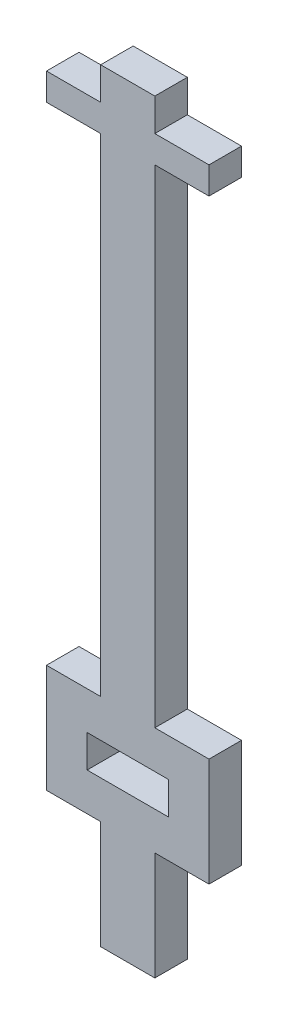
from build123d import *

# Parameters (mm, degrees)
BOSS_EXTRUDE1_DEPTH      = 7.62
BOSS_EXTRUDE2_DEPTH      = 12.7
BOSS_EXTRUDE2_DEPTH_BACK = 25.4
SKETCH2_W                = 7.62
SKETCH2_H                = 25.4
SKETCH3_W                = 19.05
SKETCH3_H                = 7.62
CUT_EXTRUDE1_DEPTH       = 182.02289717


with BuildPart() as part:
    # Sketch1 → Boss-Extrude1 (new body)
    with BuildSketch(Plane.XY):
        Polygon((0, 0), (12.7, 0), (12.7, 165.1), (25.4, 165.1), (25.4, 171.45), (12.7, 171.45), (12.7, 179.07), (0, 179.07), (0, 171.45), (-12.7, 171.45), (-12.7, 165.1), (0, 165.1), align=None)
    extrude(amount=BOSS_EXTRUDE1_DEPTH)

    # Sketch2 → Boss-Extrude2 (add, two sides: drawn at the far end of the back side and taken through both)
    with BuildSketch(Plane.ZY.offset(-BOSS_EXTRUDE2_DEPTH_BACK)):
        with Locations((3.81, 38.1)):
            Rectangle(SKETCH2_W, SKETCH2_H)
    extrude(amount=BOSS_EXTRUDE2_DEPTH + BOSS_EXTRUDE2_DEPTH_BACK)

    # Sketch3 → Cut-Extrude1 (cut, through all)
    with BuildSketch(Plane.XY.offset(7.62)):
        with Locations((6.35, 38.1)):
            Rectangle(SKETCH3_W, SKETCH3_H)
    extrude(amount=-CUT_EXTRUDE1_DEPTH, mode=Mode.SUBTRACT)


solid = part.part
